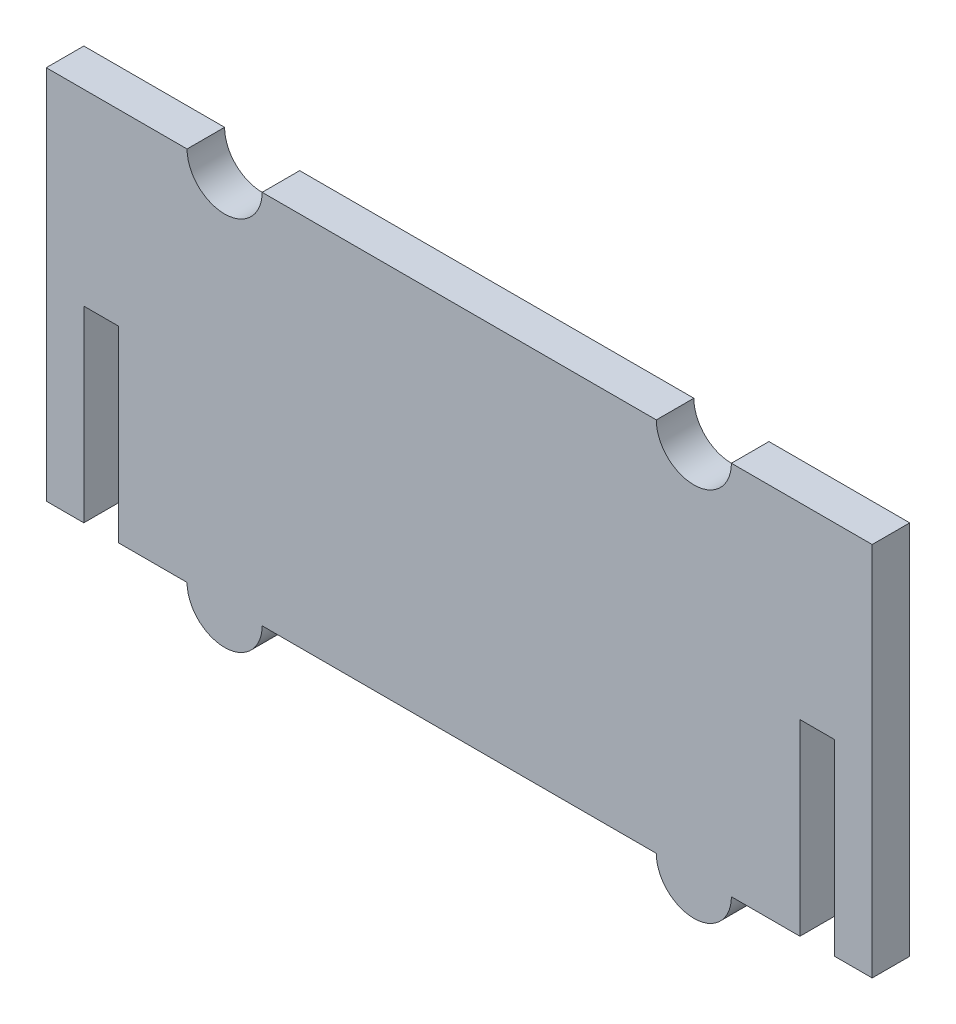
from build123d import *

# Parameters (mm, degrees)
BOSS_EXTRUDE1_DEPTH = 4


with BuildPart() as part:
    # Sketch1 → Boss-Extrude1 (new body)
    with BuildSketch(Plane.XY):
        with BuildLine():
            Line((7.7, 0), (15, 0))
            ThreePointArc((15, 0), (19, -4), (23, 0))
            Line((23, 0), (65, 0))
            ThreePointArc((65, 0), (69, -4), (73, 0))
            Line((73, 0), (80.3, 0))
            Line((80.3, 0), (80.3, 20))
            Line((80.3, 20), (84, 20))
            Line((84, 20), (84, 0))
            Line((84, 0), (88, 0))
            Line((88, 0), (88, 40))
            Line((88, 40), (73, 40))
            ThreePointArc((73, 40), (69, 36), (65, 40))
            Line((65, 40), (23, 40))
            ThreePointArc((23, 40), (19, 36), (15, 40))
            Line((15, 40), (0, 40))
            Line((0, 40), (0, 0))
            Line((0, 0), (4, 0))
            Line((4, 0), (4, 20))
            Line((4, 20), (7.7, 20))
            Line((7.7, 20), (7.7, 0))
        make_face()
    extrude(amount=BOSS_EXTRUDE1_DEPTH)


solid = part.part
